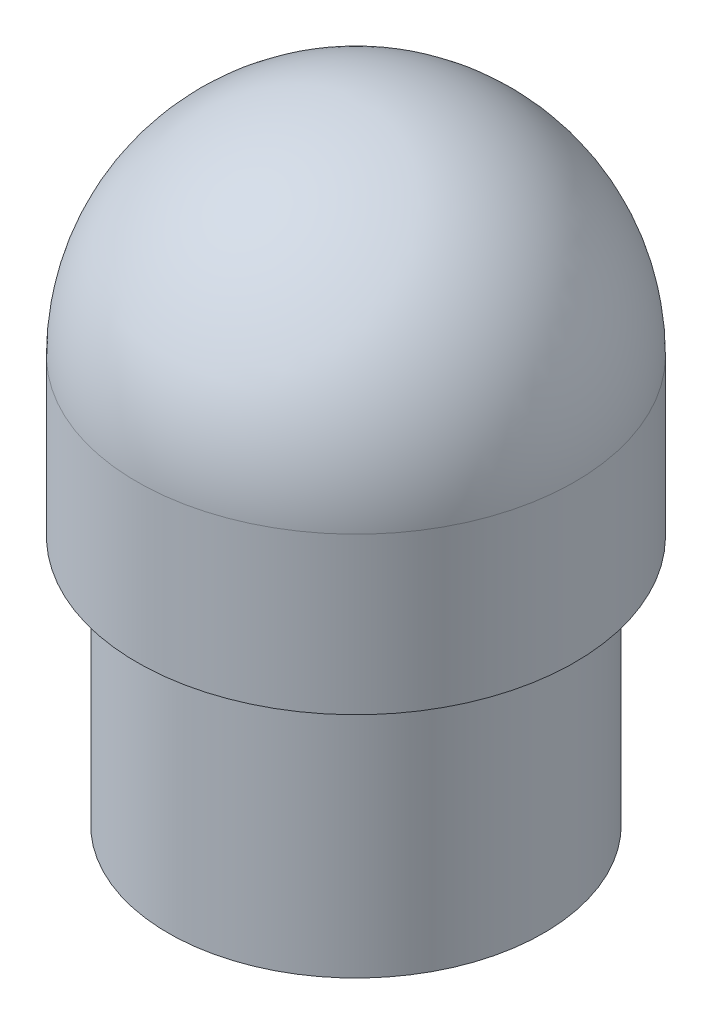
from build123d import *

# Parameters (mm, degrees)
SKETCH_1_W = 15
SKETCH_1_H = 20
FILLET_1_R = 17.5


with BuildPart() as part:
    # 草圖1 → 旋轉1 (revolve)
    with BuildSketch(Plane.XY, mode=Mode.PRIVATE) as revolve_1_sk:
        with Locations((7.5, 10)):
            Rectangle(SKETCH_1_W, SKETCH_1_H)
        Polygon((0, 50), (0, 20), (15, 20), (17.5, 20), (17.5, 50), align=None)
    revolve(revolve_1_sk.sketch.rotate(Axis((0, 20, 0), (0, 1, 0)), 90), axis=Axis((0, 20, 0), (0, 1, 0)))

    # 圓角1
    fillet_1_edges = [part.edges().sort_by_distance(p)[0] for p in [
        (0, 50, 17.5),
    ]]
    fillet(fillet_1_edges, radius=FILLET_1_R)


solid = part.part
